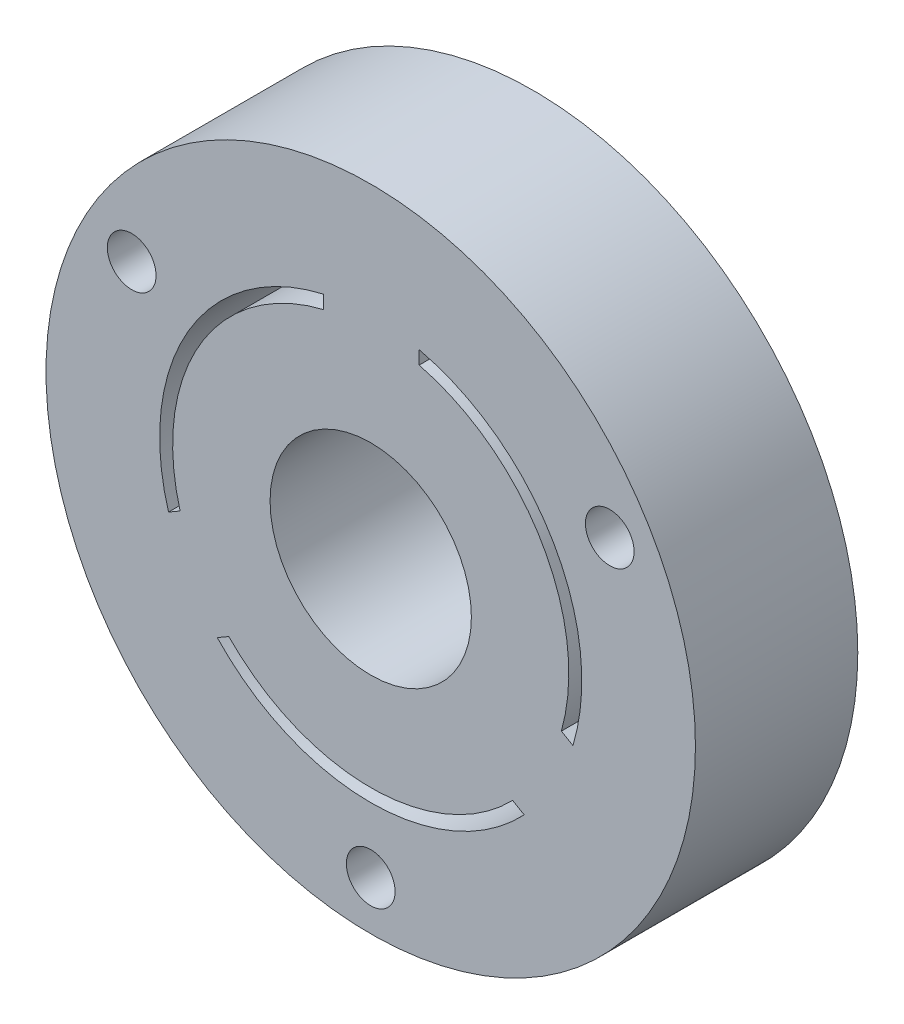
from build123d import *

# Parameters (mm, degrees)
SKETCH_1_R          = 3.1
EXTRUDE_2_DEPTH     = 5
SKETCH_2_R          = 0.75
CUT_EXTRUDE_1_DEPTH = 5


with BuildPart() as part:
    # 草图1 → 凸台-拉伸2 (new body)
    # profile 1 of 13: a face of its own
    with BuildSketch(Plane.XY):
        with BuildLine():
            ThreePointArc((46.84834221, 37.819497557), (39.649360268, 32.947597766), (38.98420246, 24.280515578))
            Line((38.98420246, 24.280515578), (42.06924878, 26.061667901))
            ThreePointArc((42.06924878, 26.061667901), (42.680670311, 31.197940443), (46.84834221, 34.261540101))
            Line((46.84834221, 34.261540101), (46.84834221, 37.819497557))
        make_face()
    # profile 2 of 13: a face of its own
    with BuildSketch(Plane.XY):
        with BuildLine():
            Line((54.52369993, 26.061667901), (57.60874625, 24.280515578))
            ThreePointArc((57.60874625, 24.280515578), (58.123038326, 26.070550282), (58.296474355, 27.924907455))
            ThreePointArc((58.296474355, 27.924907455), (55.876532608, 34.447385273), (49.787930978, 37.813059818))
            Line((49.787930978, 37.813059818), (49.787930978, 34.251482923))
            ThreePointArc((49.787930978, 34.251482923), (53.392770463, 31.959478805), (54.796474355, 27.924907455))
            ThreePointArc((54.796474355, 27.924907455), (54.727919225, 26.983357201), (54.52369993, 26.061667901))
        make_face()
    # profile 3 of 13: a face of its own
    with BuildSketch(Plane.XY):
        with BuildLine():
            ThreePointArc((40.48420246, 21.682439366), (48.296474355, 17.924907455), (56.10874625, 21.682439366))
            Line((56.10874625, 21.682439366), (53.02369993, 23.463591689))
            ThreePointArc((53.02369993, 23.463591689), (48.296474355, 21.424907455), (43.56924878, 23.463591689))
            Line((43.56924878, 23.463591689), (40.48420246, 21.682439366))
        make_face()
    # profile 4 of 13: a face of its own
    with BuildSketch(Plane.XY):
        with BuildLine():
            ThreePointArc((38.98420246, 24.280515578), (39.636220317, 22.924907455), (40.48420246, 21.682439366))
            Line((40.48420246, 21.682439366), (43.56924878, 23.463591689))
            ThreePointArc((43.56924878, 23.463591689), (42.66730923, 24.674907455), (42.06924878, 26.061667901))
            Line((42.06924878, 26.061667901), (38.98420246, 24.280515578))
        make_face()
    # profile 5 of 13: a face of its own
    with BuildSketch(Plane.XY):
        with BuildLine():
            ThreePointArc((42.06924878, 26.061667901), (42.66730923, 24.674907455), (43.56924878, 23.463591689))
            Line((43.56924878, 23.463591689), (43.925927509, 23.66952025))
            ThreePointArc((43.925927509, 23.66952025), (43.013719392, 24.874907455), (42.425927509, 26.267596461))
            Line((42.425927509, 26.267596461), (42.06924878, 26.061667901))
        make_face()
    # profile 6 of 13: a face of its own
    with BuildSketch(Plane.XY):
        with BuildLine():
            Line((52.565394479, 27.19229608), (54.167021201, 26.267596461))
            ThreePointArc((54.167021201, 26.267596461), (54.338838783, 27.088347762), (54.396474355, 27.924907455))
            ThreePointArc((54.396474355, 27.924907455), (53.108328748, 31.67404833), (49.787930978, 33.839766468))
            Line((49.787930978, 33.839766468), (49.787930978, 32.638782116))
            Line((49.787930978, 32.638782116), (46.84834221, 32.638782116))
            Line((46.84834221, 32.638782116), (46.84834221, 33.850522469))
            ThreePointArc((46.84834221, 33.850522469), (43.027133101, 30.998023585), (42.425927509, 26.267596461))
            Line((42.425927509, 26.267596461), (43.927397053, 27.134470306))
            Line((43.927397053, 27.134470306), (45.427397053, 24.536394095))
            Line((45.427397053, 24.536394095), (43.925927509, 23.66952025))
            ThreePointArc((43.925927509, 23.66952025), (48.296474355, 21.824907455), (52.667021201, 23.66952025))
            Line((52.667021201, 23.66952025), (51.065394479, 24.594219869))
            Line((51.065394479, 24.594219869), (52.565394479, 27.19229608))
        make_face()
        with Locations((48.296474355, 27.924907455)):
            Circle(SKETCH_1_R, mode=Mode.SUBTRACT)
    # profile 7 of 13: a face of its own
    with BuildSketch(Plane.XY):
        with BuildLine():
            ThreePointArc((42.425927509, 26.267596461), (43.013719392, 24.874907455), (43.925927509, 23.66952025))
            Line((43.925927509, 23.66952025), (45.427397053, 24.536394095))
            Line((45.427397053, 24.536394095), (43.927397053, 27.134470306))
            Line((43.927397053, 27.134470306), (42.425927509, 26.267596461))
        make_face()
    # profile 8 of 13: a face of its own
    with BuildSketch(Plane.XY):
        with BuildLine():
            ThreePointArc((52.667021201, 23.66952025), (53.579229318, 24.874907455), (54.167021201, 26.267596461))
            Line((54.167021201, 26.267596461), (52.565394479, 27.19229608))
            Line((52.565394479, 27.19229608), (51.065394479, 24.594219869))
            Line((51.065394479, 24.594219869), (52.667021201, 23.66952025))
        make_face()
    # profile 9 of 13: a face of its own
    with BuildSketch(Plane.XY):
        with BuildLine():
            Line((49.787930978, 32.638782116), (49.787930978, 33.839766468))
            ThreePointArc((49.787930978, 33.839766468), (48.3187942, 34.024866621), (46.84834221, 33.850522469))
            Line((46.84834221, 33.850522469), (46.84834221, 32.638782116))
            Line((46.84834221, 32.638782116), (49.787930978, 32.638782116))
        make_face()
    # profile 10 of 13: a face of its own
    with BuildSketch(Plane.XY):
        with BuildLine():
            Line((49.787930978, 33.839766468), (49.787930978, 34.251482923))
            ThreePointArc((49.787930978, 34.251482923), (48.318712594, 34.424869414), (46.84834221, 34.261540101))
            Line((46.84834221, 34.261540101), (46.84834221, 33.850522469))
            ThreePointArc((46.84834221, 33.850522469), (48.3187942, 34.024866621), (49.787930978, 33.839766468))
        make_face()
    # profile 11 of 13: a face of its own
    with BuildSketch(Plane.XY):
        with BuildLine():
            ThreePointArc((53.02369993, 23.463591689), (53.92563948, 24.674907455), (54.52369993, 26.061667901))
            Line((54.52369993, 26.061667901), (54.167021201, 26.267596461))
            ThreePointArc((54.167021201, 26.267596461), (53.579229318, 24.874907455), (52.667021201, 23.66952025))
            Line((52.667021201, 23.66952025), (53.02369993, 23.463591689))
        make_face()
    # profile 12 of 13: a face of its own
    with BuildSketch(Plane.XY):
        with BuildLine():
            ThreePointArc((56.10874625, 21.682439366), (56.956728393, 22.924907455), (57.60874625, 24.280515578))
            Line((57.60874625, 24.280515578), (54.52369993, 26.061667901))
            ThreePointArc((54.52369993, 26.061667901), (53.92563948, 24.674907455), (53.02369993, 23.463591689))
            Line((53.02369993, 23.463591689), (56.10874625, 21.682439366))
        make_face()
    # profile 13 of 13: a face of its own
    with BuildSketch(Plane.XY):
        with BuildLine():
            Line((49.787930978, 34.251482923), (49.787930978, 37.813059818))
            ThreePointArc((49.787930978, 37.813059818), (48.31837444, 37.924883475), (46.84834221, 37.819497557))
            Line((46.84834221, 37.819497557), (46.84834221, 34.261540101))
            ThreePointArc((46.84834221, 34.261540101), (48.318712594, 34.424869414), (49.787930978, 34.251482923))
        make_face()
    extrude(amount=EXTRUDE_2_DEPTH)

    # 草图2 → 切除-拉伸1 (cut)
    with BuildSketch(Plane.XY.offset(5)):
        with Locations((40.935258423, 32.174907455)):
            Circle(SKETCH_2_R)
        with Locations((55.657690287, 32.174907455)):
            Circle(SKETCH_2_R)
        with Locations((48.296474355, 19.424907455)):
            Circle(SKETCH_2_R)
    extrude(amount=-CUT_EXTRUDE_1_DEPTH, mode=Mode.SUBTRACT)


solid = part.part
